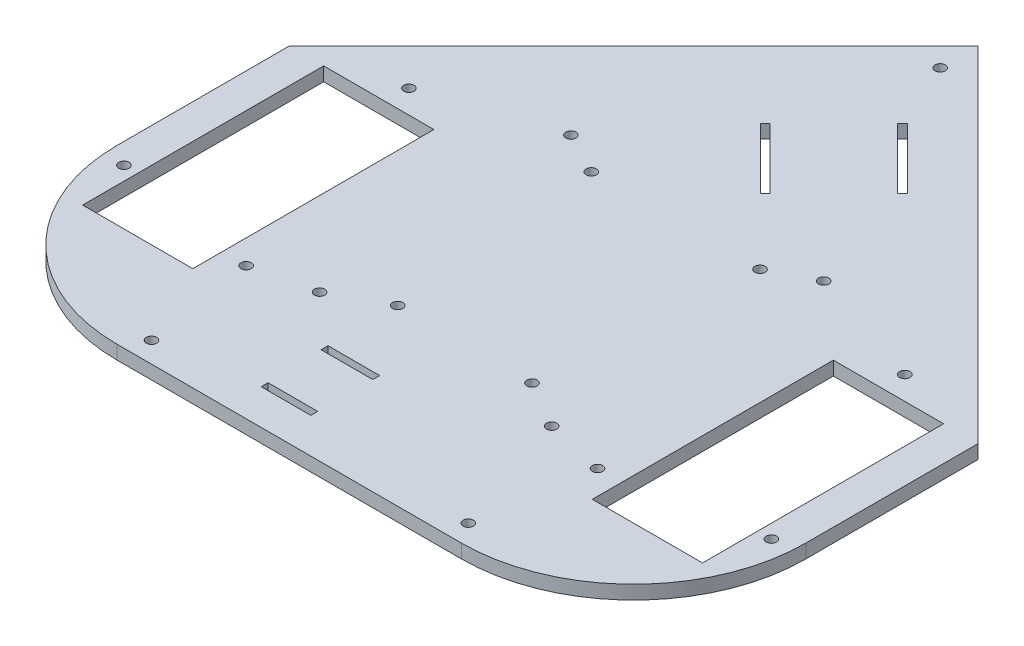
from build123d import *

# Parameters (mm, degrees)
BASIS_GRONDPLAAT_DEPTH = 4
WIELGATEN_SCHETS_W     = 32
WIELGATEN_SCHETS_H     = 70
WIELGATEN_DEPTH        = 10
BOORGAT1_SCHETS_R      = 1.5
BOORGAT1_DEPTH         = 181.321934329
SKETCH1_R              = 1.5
SKETCH1_W              = 15
SKETCH1_H              = 2
SKETCH1_W_2            = 14.4
CUT_EXTRUDE1_DEPTH     = 10
SKETCH2_R              = 1.5
CUT_EXTRUDE2_DEPTH     = 10


with BuildPart() as part:
    # basis_grondplaat_schets → basis_grondplaat (new body)
    with BuildSketch(Plane(origin=(0, 0, 0), x_dir=(1, 0, 0), z_dir=(0, 1, 0))):
        with BuildLine():
            Line((-50, -50), (50, -50))
            ThreePointArc((50, -50), (85.355339059, -35.355339059), (100, 0))
            Line((100, 0), (100, 50))
            Line((100, 50), (0, 150))
            Line((0, 150), (-100, 50))
            Line((-100, 50), (-100, 0))
            ThreePointArc((-100, 0), (-85.355339059, -35.355339059), (-50, -50))
        make_face()
    extrude(amount=BASIS_GRONDPLAAT_DEPTH)

    # wielgaten_schets → wielgaten (cut)
    with BuildSketch(Plane(origin=(0, 4, 0), x_dir=(1, 0, 0), z_dir=(0, 1, 0))):
        with Locations((-74, 15)):
            Rectangle(WIELGATEN_SCHETS_W, WIELGATEN_SCHETS_H)
    wielgaten = extrude(amount=-WIELGATEN_DEPTH, mode=Mode.SUBTRACT)

    # boorgat1_schets → boorgat1 (cut, through all)
    with BuildSketch(Plane.XZ):
        with Locations(Location((-46, 44, 0), (0, 0, 270))):
            Circle(BOORGAT1_SCHETS_R)
    extrude(amount=-BOORGAT1_DEPTH, mode=Mode.SUBTRACT)

    # Mirror1: wielgaten across plane
    add(wielgaten.mirror(Plane(origin=(0, 0, 0), x_dir=(0, 0, 1), z_dir=(1, 0, 0))), mode=Mode.SUBTRACT)

    # Sketch1 → Cut-Extrude1 (cut)
    with BuildSketch(Plane(origin=(0, 0, 0), x_dir=(-1, 0, 0), z_dir=(0, -1, 0))):
        with Locations(Location((-46, -44, 0), (0, 0, 90))):
            Circle(SKETCH1_R)
        with Locations(Location((-94, -4, 0), (0, 0, 90))):
            Circle(SKETCH1_R)
        with Locations(Location((94, -4, 0), (0, 0, 90))):
            Circle(SKETCH1_R)
        with Locations(Location((0, 139, 0), (0, 0, 90))):
            Circle(SKETCH1_R)
        with Locations(Location((24.5, 62.2, 0), (0, 0, 90))):
            Circle(SKETCH1_R)
        with Locations(Location((-24.5, 62.2, 0), (0, 0, 90))):
            Circle(SKETCH1_R)
        with Locations(Location((-20, 0.5, 0), (0, 0, 90))):
            Circle(SKETCH1_R)
        with Locations(Location((19, 0.5, 0), (0, 0, 90))):
            Circle(SKETCH1_R)
        Polygon((10.751885446, 100.378121725), (-6.925784083, 82.700452195), (-5.511570521, 81.286238633), (12.166099009, 98.963908163), align=None)
        Polygon((-25.45198175, 101.226649863), (-7.774312221, 118.904319392), (-9.188525783, 120.318532955), (-26.866195313, 102.640863425), align=None)
        with Locations((11.5, -20.75)):
            Rectangle(SKETCH1_W, SKETCH1_H)
        with Locations((11.2, -38.75)):
            Rectangle(SKETCH1_W_2, SKETCH1_H)
    extrude(amount=-CUT_EXTRUDE1_DEPTH, mode=Mode.SUBTRACT)

    # Sketch2 → Cut-Extrude2 (cut)
    with BuildSketch(Plane(origin=(0, 0, 0), x_dir=(-1, 0, 0), z_dir=(0, -1, 0))):
        with Locations(Location((51, -11.5, 0), (0, 0, 90))):
            Circle(SKETCH2_R)
        with Locations(Location((33.7, -7.5, 0), (0, 0, 90))):
            Circle(SKETCH2_R)
        with Locations(Location((-33.7, -7.5, 0), (0, 0, 90))):
            Circle(SKETCH2_R)
        with Locations(Location((-51, -11.5, 0), (0, 0, 90))):
            Circle(SKETCH2_R)
        with Locations(Location((36.7, 68.5, 0), (0, 0, 90))):
            Circle(SKETCH2_R)
        with Locations(Location((-36.7, 68.5, 0), (0, 0, 90))):
            Circle(SKETCH2_R)
        with Locations(Location((-72, 56.75, 0), (0, 0, 90))):
            Circle(SKETCH2_R)
        with Locations(Location((72, 56.75, 0), (0, 0, 90))):
            Circle(SKETCH2_R)
    extrude(amount=-CUT_EXTRUDE2_DEPTH, mode=Mode.SUBTRACT)


solid = part.part
